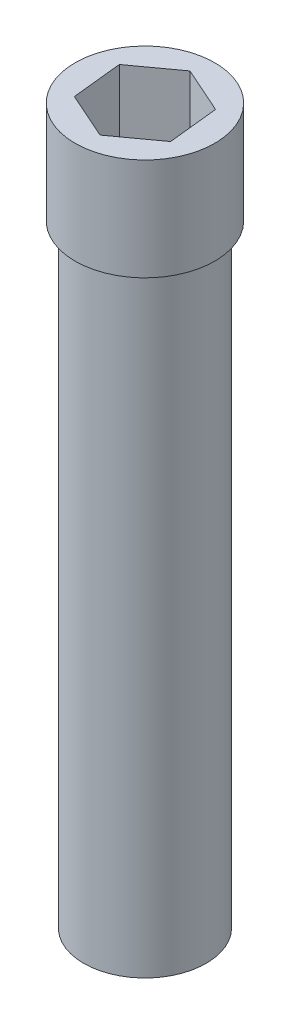
from build123d import *

# Parameters (mm, degrees)
SKETCH1_R           = 3
BOSS_EXTRUDE1_DEPTH = 30
SKETCH2_R           = 3.420462188
BOSS_EXTRUDE2_DEPTH = 5
CUT_EXTRUDE1_DEPTH  = 4


with BuildPart() as part:
    # Sketch1 → Boss-Extrude1 (new body)
    with BuildSketch(Plane(origin=(0, 0, 0), x_dir=(1, 0, 0), z_dir=(0, 1, 0))):
        with Locations(Location((0, 0, 0), (0, 0, 270))):
            Circle(SKETCH1_R)
    extrude(amount=BOSS_EXTRUDE1_DEPTH)

    # Sketch2 → Boss-Extrude2 (add)
    with BuildSketch(Plane(origin=(0, 30, 0), x_dir=(1, 0, 0), z_dir=(0, 1, 0))):
        with Locations(Location((0, 0, 0), (0, 0, 270))):
            Circle(SKETCH2_R)
    extrude(amount=BOSS_EXTRUDE2_DEPTH)

    # Sketch3 → Cut-Extrude1 (cut)
    with BuildSketch(Plane(origin=(0, 35, 0), x_dir=(1, 0, 0), z_dir=(0, 1, 0))):
        Polygon((-0.25878856, 2.462260088), (-2.261774067, 1.007012576), (-2.002985506, -1.455247511), (0.25878856, -2.462260088), (2.261774067, -1.007012576), (2.002985506, 1.455247511), align=None)
    extrude(amount=-CUT_EXTRUDE1_DEPTH, mode=Mode.SUBTRACT)


solid = part.part
